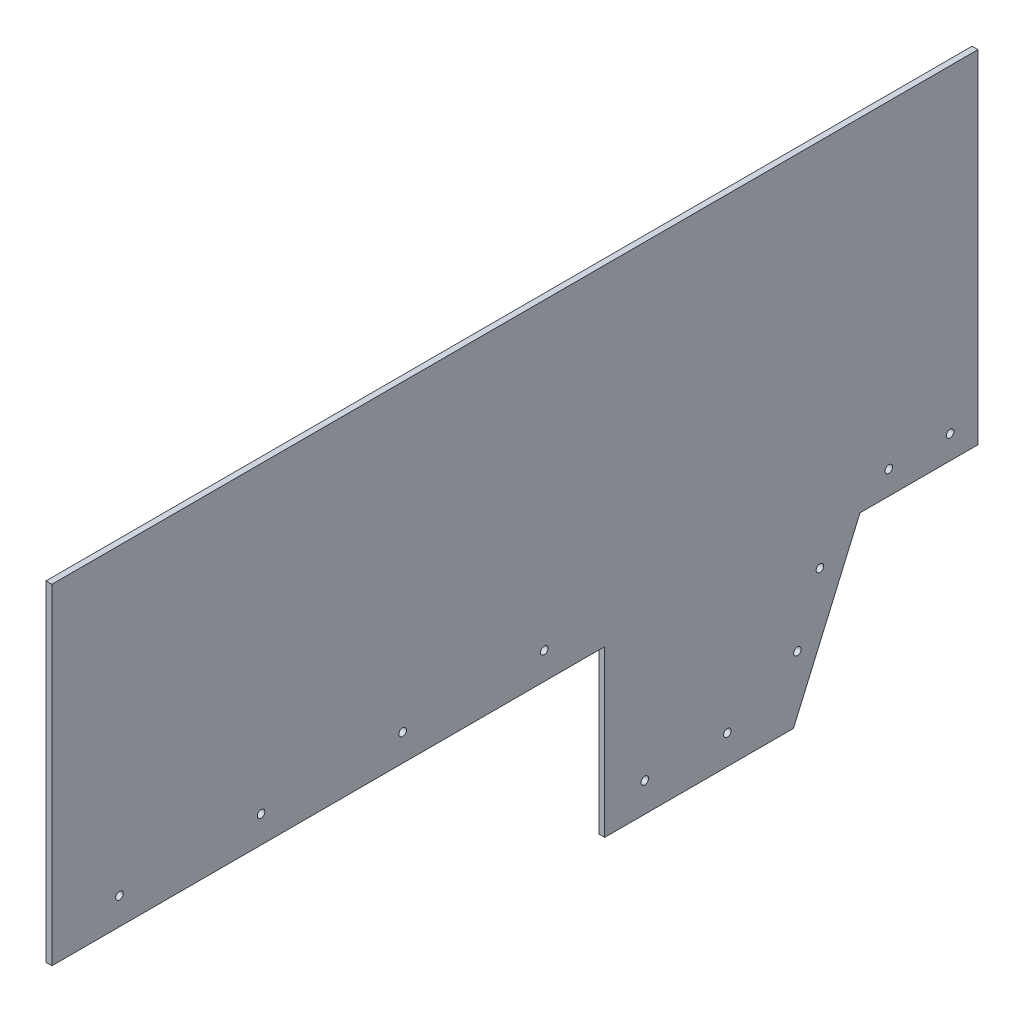
from build123d import *

# Parameters (mm, degrees)
SKETCH1_W           = 498.348
SKETCH1_H           = 177.8
BOSS_EXTRUDE1_DEPTH = 1.5875
BOSS_EXTRUDE2_DEPTH = 3.175
SKETCH3_R           = 2.025
CUT_EXTRUDE1_DEPTH  = 307.121875894
LPATTERN1_COUNT     = 4
LPATTERN1_PITCH     = 76.2
CUT_EXTRUDE2_DEPTH  = 307.121875894
LPATTERN2_COUNT     = 2
LPATTERN2_PITCH     = 44.45
SKETCH5_R           = 2.025
CUT_EXTRUDE3_DEPTH  = 307.121875894
SKETCH8_R           = 2.025
CUT_EXTRUDE5_DEPTH  = 307.121875894
SKETCH9_R           = 2.025
CUT_EXTRUDE6_DEPTH  = 307.121875894
LPATTERN4_COUNT     = 2
LPATTERN4_PITCH     = 33.02


with BuildPart() as part:
    # Sketch1 → Boss-Extrude1 (new, symmetric)
    with BuildSketch(Plane(origin=(0, 0, 0), x_dir=(0, 0, -1), z_dir=(1, 0, 0))):
        Rectangle(SKETCH1_W, SKETCH1_H)
    extrude(amount=BOSS_EXTRUDE1_DEPTH, both=True)

    # Sketch2 → Boss-Extrude2 (add)
    with BuildSketch(Plane(origin=(1.5875, 0, 0), x_dir=(0, 0, -1), z_dir=(1, 0, 0))):
        Polygon((249.174, -95.25), (249.174, -88.9), (48.2854, -88.9), (48.2854, -177.8), (149.8854, -177.8), (185.674, -95.25), align=None)
    extrude(amount=-BOSS_EXTRUDE2_DEPTH)

    # Sketch3 → Cut-Extrude1 (cut, through all)
    with BuildSketch(Plane(origin=(1.5875, 0, 0), x_dir=(0, 0, -1), z_dir=(1, 0, 0))):
        with Locations((15.7854, -74.363480824)):
            Circle(SKETCH3_R)
    cut_extrude1 = extrude(amount=-CUT_EXTRUDE1_DEPTH, mode=Mode.SUBTRACT)

    # LPattern1: Cut-Extrude1 ×4
    with Locations(*[(0, 0, i * LPATTERN1_PITCH) for i in range(1, LPATTERN1_COUNT)]):
        add(cut_extrude1, mode=Mode.SUBTRACT)

    # Sketch4 → Cut-Extrude2 (cut, through all)
    with BuildSketch(Plane.ZY.offset(1.5875)):
        with BuildLine():
            ThreePointArc((-67.8504, -162.052), (-71.307291232, -160.620108768), (-69.8754, -164.077))
            Line((-69.8754, -164.077), (-69.8754, -162.052))
            Line((-69.8754, -162.052), (-67.8504, -162.052))
        make_face()
        with BuildLine():
            Line((-69.8754, -162.052), (-69.8754, -164.077))
            ThreePointArc((-69.8754, -164.077), (-68.443508768, -163.483891232), (-67.8504, -162.052))
            Line((-67.8504, -162.052), (-69.8754, -162.052))
        make_face()
    cut_extrude2 = extrude(amount=-CUT_EXTRUDE2_DEPTH, mode=Mode.SUBTRACT)

    # LPattern2: Cut-Extrude2 ×2
    with Locations(*[(0, 0, -i * LPATTERN2_PITCH) for i in range(1, LPATTERN2_COUNT)]):
        add(cut_extrude2, mode=Mode.SUBTRACT)

    # Sketch5 → Cut-Extrude3 (cut, through all)
    with BuildSketch(Plane.ZY.offset(1.5875)):
        with Locations((-152.00472504, -142.898934489)):
            Circle(SKETCH5_R)
    extrude(amount=-CUT_EXTRUDE3_DEPTH, mode=Mode.SUBTRACT)

    # Sketch8 → Cut-Extrude5 (cut, through all)
    with BuildSketch(Plane.ZY.offset(1.5875)):
        with Locations((-164.117120252, -110.224827622)):
            Circle(SKETCH8_R)
    extrude(amount=-CUT_EXTRUDE5_DEPTH, mode=Mode.SUBTRACT)

    # Sketch9 → Cut-Extrude6 (cut, through all)
    with BuildSketch(Plane.ZY.offset(1.5875)):
        with Locations((-201.170653386, -82.55)):
            Circle(SKETCH9_R)
    cut_extrude6 = extrude(amount=-CUT_EXTRUDE6_DEPTH, mode=Mode.SUBTRACT)

    # LPattern4: Cut-Extrude6 ×2
    with Locations(*[(0, 0, -i * LPATTERN4_PITCH) for i in range(1, LPATTERN4_COUNT)]):
        add(cut_extrude6, mode=Mode.SUBTRACT)


solid = part.part
